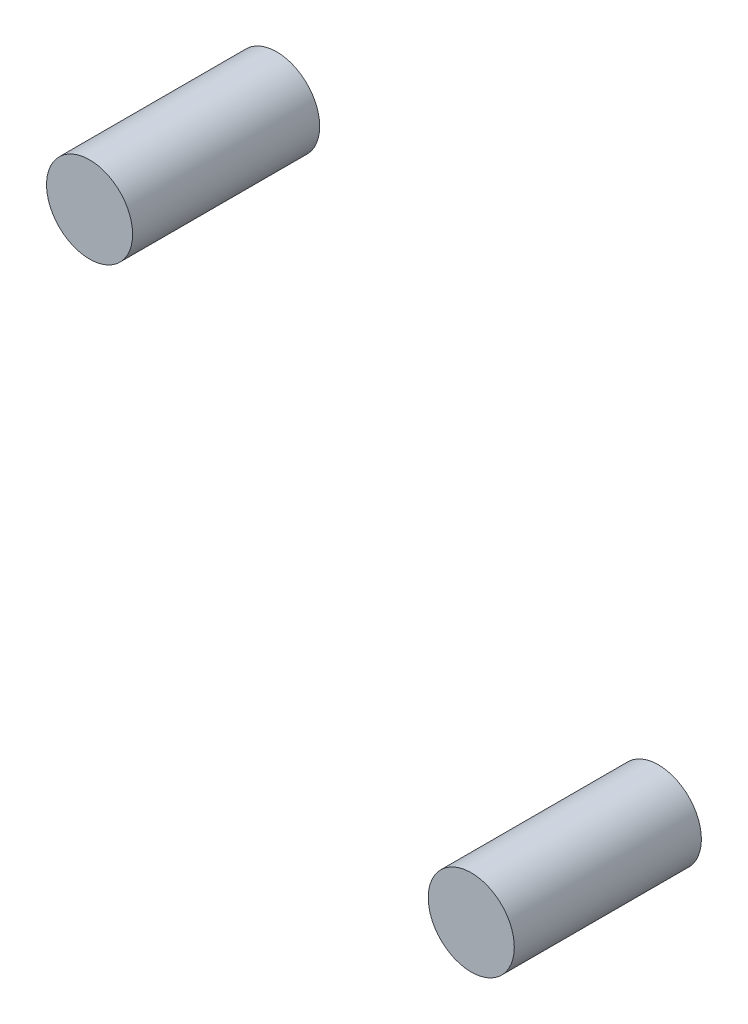
from build123d import *

# Parameters (mm, degrees)
SKETCH_1_R        = 5.75
EXTRUDE_1_DEPTH   = 25
EXTRUDE_1_2_DEPTH = 25


with BuildPart() as part:
    # 草图1 → 凸台-拉伸1 (new body)
    with BuildSketch(Plane.XY):
        with Locations((16.447815059, 49.169003886)):
            Circle(SKETCH_1_R)
    extrude(amount=EXTRUDE_1_DEPTH)


with BuildPart() as body_2:
    # 草图1 → Extrude 1 2 (new body)
    with BuildSketch(Plane.XY):
        with Locations((67.447815059, -7.830996114)):
            Circle(SKETCH_1_R)
    extrude(amount=EXTRUDE_1_2_DEPTH)


solid = Compound([part.part, body_2.part])
